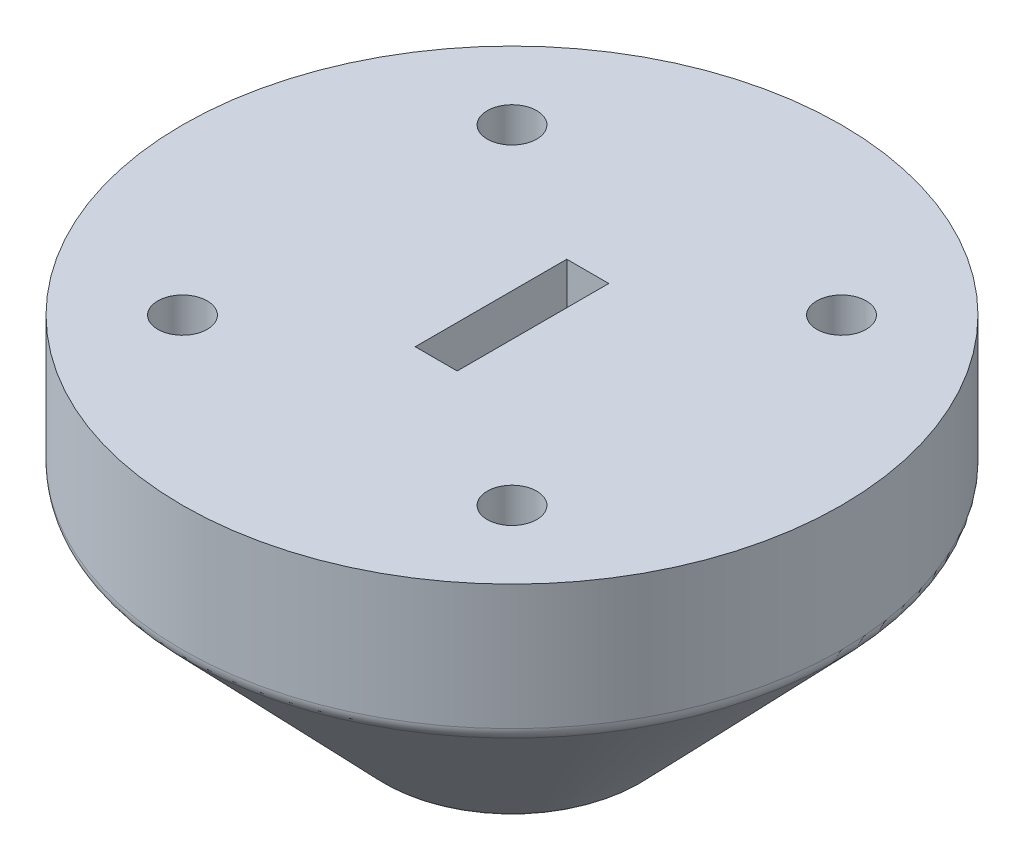
from build123d import *

# Parameters (mm, degrees)
F_6_0MM_DOWEL_HOLE7_D     = 6
F_6_0MM_DOWEL_HOLE7_DEPTH = 12
F_6_0MM_DOWEL_HOLE7_TIP   = 3
CUT_EXTRUDE1_DEPTH        = 9.2
CUT_EXTRUDE1_DEPTH_BACK   = 9.2
FILLET1_R                 = 2
FILLET2_R                 = 2
FILLET6_R                 = 1
FILLET7_R                 = 1
BOSS_EXTRUDE1_DEPTH       = 10
BOSS_EXTRUDE1_DEPTH_BACK  = 10
FILLET8_R                 = 1


with BuildPart() as part:
    # Sketch1 → Revolve1 (revolve)
    with BuildSketch(Plane.XY):
        Polygon((0, 0), (40, 0), (40, -16), (15, -42), (0, -42), align=None)
    revolve(axis=Axis((0, -42, 0), (0, 1, 0)))

    # Ø6.0mm Dowel Hole7
    with Locations(Plane(origin=(0, 0, 0), x_dir=(1, 0, 0), z_dir=(0, 1, 0))):
        with Locations((20, -20), (-20, 20), (-20, -20), (20, 20)):
            Hole(F_6_0MM_DOWEL_HOLE7_D / 2, depth=F_6_0MM_DOWEL_HOLE7_DEPTH)
            with Locations((0, 0, -(F_6_0MM_DOWEL_HOLE7_DEPTH + F_6_0MM_DOWEL_HOLE7_TIP / 2))):  # 90° drill point
                Cone(0, F_6_0MM_DOWEL_HOLE7_D / 2, F_6_0MM_DOWEL_HOLE7_TIP, mode=Mode.SUBTRACT)

    # Sketch13 → Cut-Extrude1 (cut, two sides: drawn at the far end of the back side and taken through both)
    with BuildSketch(Plane.XY.offset(-CUT_EXTRUDE1_DEPTH_BACK)):
        Polygon((-2.55, 0), (2.55, 0), (2.55, -20), (1, -40), (-1, -40), (-2.55, -20), align=None)
    extrude(amount=CUT_EXTRUDE1_DEPTH + CUT_EXTRUDE1_DEPTH_BACK, mode=Mode.SUBTRACT)

    # Fillet1
    fillet1_edges = [part.edges().sort_by_distance(p)[0] for p in [
        (-15, -42, 0),
    ]]
    fillet(fillet1_edges, radius=FILLET1_R)

    # Fillet2
    fillet2_edges = [part.edges().sort_by_distance(p)[0] for p in [
        (-40, -16, 0),
    ]]
    fillet(fillet2_edges, radius=FILLET2_R)

    # Fillet6
    fillet6_edges = [part.edges().sort_by_distance(p)[0] for p in [
        (1, -40, 0),
    ]]
    fillet(fillet6_edges, radius=FILLET6_R)

    # Fillet7
    fillet7_edges = [part.edges().sort_by_distance(p)[0] for p in [
        (-1, -40, 0),
    ]]
    fillet(fillet7_edges, radius=FILLET7_R)

    # Sketch14 → Boss-Extrude1 (add, two sides: drawn at the far end of the back side and taken through both)
    with BuildSketch(Plane(origin=(0, 0, 0), x_dir=(0, 0, -1), z_dir=(1, 0, 0)).offset(-BOSS_EXTRUDE1_DEPTH_BACK)):
        Polygon((9.2, -30), (12.2, -27), (9.2, -24), (6.2, -27), align=None)
    extrude(amount=BOSS_EXTRUDE1_DEPTH + BOSS_EXTRUDE1_DEPTH_BACK)

    # Fillet8
    fillet8_edges = [part.edges().sort_by_distance(p)[0] for p in [
        (0, -27, -6.2),
    ]]
    fillet(fillet8_edges, radius=FILLET8_R)


solid = part.part
